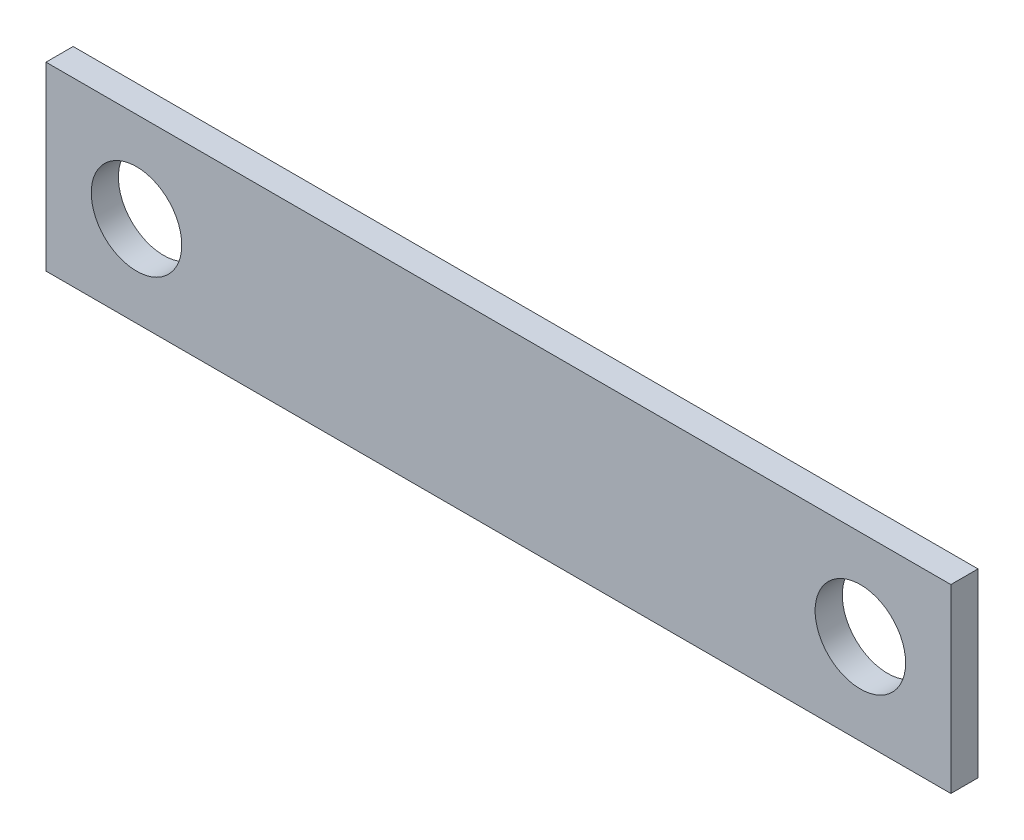
from build123d import *

# Parameters (mm, degrees)
SKETCH_1_W          = 100
SKETCH_1_H          = 20
EXTRUDE_1_DEPTH     = 3
SKETCH_2_R          = 5
CUT_EXTRUDE_1_DEPTH = 3


with BuildPart() as part:
    # ｽｹｯﾁ1 → ﾎﾞｽ - 押し出し1 (new body)
    with BuildSketch(Plane.XY):
        with Locations((50, 10)):
            Rectangle(SKETCH_1_W, SKETCH_1_H)
    extrude(amount=EXTRUDE_1_DEPTH)

    # ｽｹｯﾁ2 → ｶｯﾄ - 押し出し1 (cut)
    with BuildSketch(Plane.XY.offset(3)):
        with Locations((10, 10)):
            Circle(SKETCH_2_R)
        with Locations((90, 10)):
            Circle(SKETCH_2_R)
    extrude(amount=-CUT_EXTRUDE_1_DEPTH, mode=Mode.SUBTRACT)


solid = part.part
